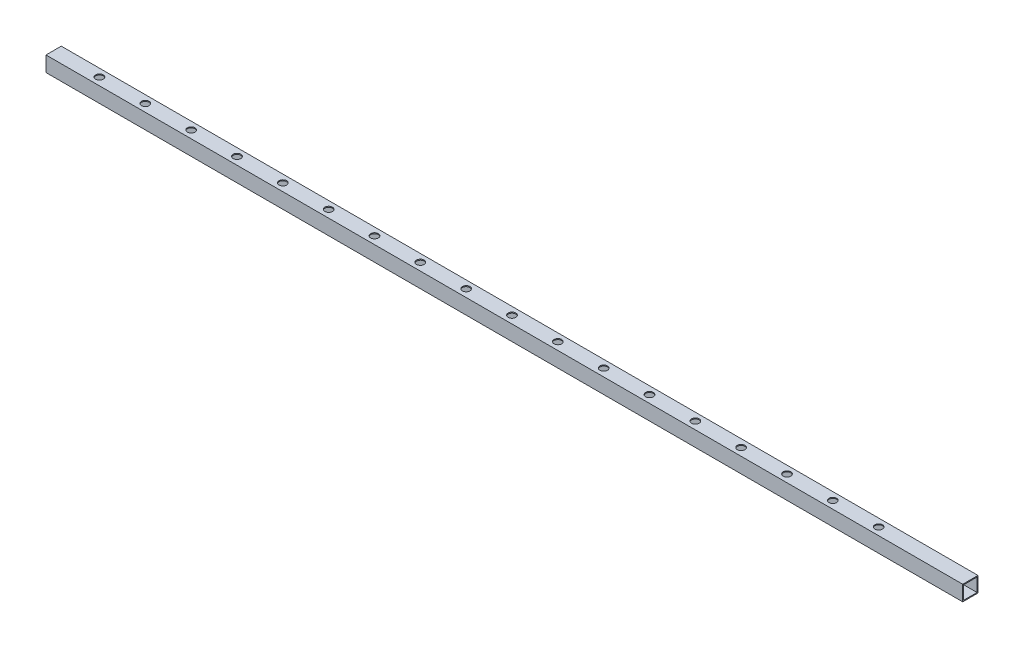
from build123d import *

# Parameters (mm, degrees)
SKETCH1_W                      = 25.4
SKETCH1_H                      = 25.4
SKETCH1_W_2                    = 22.225
SKETCH1_H_2                    = 22.225
BOSS_EXTRUDE1_DEPTH            = 1524
F_1_2_0_5_DIAMETER_HOLE1_D     = 12.7
F_1_2_0_5_DIAMETER_HOLE1_DEPTH = 1.5875
LPATTERN1_COUNT                = 18
LPATTERN1_PITCH                = 76.2


with BuildPart() as part:
    # Sketch1 → Boss-Extrude1 (new body)
    with BuildSketch(Plane(origin=(0, 0, 0), x_dir=(0, 0, -1), z_dir=(1, 0, 0))):
        Rectangle(SKETCH1_W, SKETCH1_H)
        Rectangle(SKETCH1_W_2, SKETCH1_H_2, mode=Mode.SUBTRACT)
    extrude(amount=BOSS_EXTRUDE1_DEPTH)

    # 1/2 (0.5) Diameter Hole1
    with Locations(Plane(origin=(0, 12.7, 0), x_dir=(1, 0, 0), z_dir=(0, 1, 0))):
        with Locations((1371.6, 0)):
            f_1_2_0_5_diameter_hole1 = Hole(F_1_2_0_5_DIAMETER_HOLE1_D / 2, depth=F_1_2_0_5_DIAMETER_HOLE1_DEPTH)

    # LPattern1: 1/2 (0.5) Diameter Hole1 ×18
    with Locations(*[(-i * LPATTERN1_PITCH, 0, 0) for i in range(1, LPATTERN1_COUNT)]):
        add(f_1_2_0_5_diameter_hole1, mode=Mode.SUBTRACT)


solid = part.part
